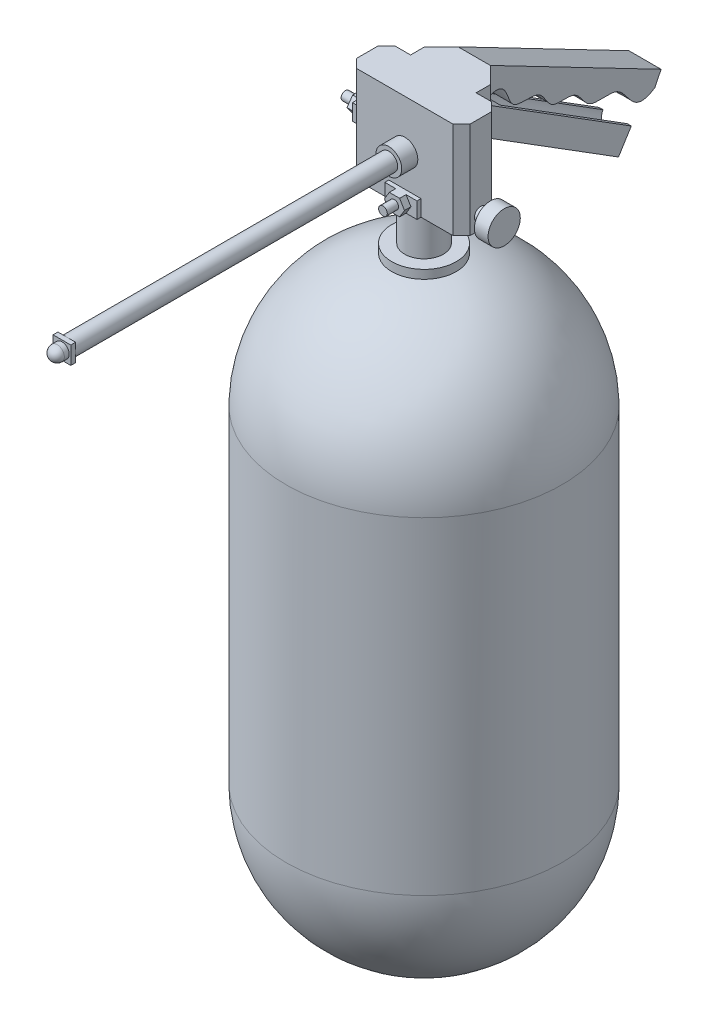
from build123d import *
from build123d.topology import SkipClean

# Parameters (mm, degrees)
SKETCH1_R                = 85.725
BOSS_EXTRUDE1_DEPTH      = 203.2
BOSS_EXTRUDE2_DEPTH      = 3
BOSS_EXTRUDE2_DEPTH_BACK = 3
SKETCH31_R               = 20
SKETCH32_R               = 12
BOSS_EXTRUDE3_DEPTH      = 25
BOSS_EXTRUDE6_DEPTH      = 60
SKETCH34_R               = 4
BOSS_EXTRUDE7_DEPTH      = 6
SKETCH35_R               = 10
BOSS_EXTRUDE8_DEPTH      = 8.5
SKETCH36_W               = 20
SKETCH36_H               = 10
BOSS_EXTRUDE9_DEPTH      = 2.5
BOSS_EXTRUDE10_DEPTH     = 4
SKETCH38_R               = 2.7
BOSS_EXTRUDE11_DEPTH     = 7
SKETCH39_W               = 13.421237438
SKETCH39_H               = 10
BOSS_EXTRUDE12_DEPTH     = 2.5
BOSS_EXTRUDE13_DEPTH     = 4
SKETCH41_R               = 2.7
BOSS_EXTRUDE14_DEPTH     = 7
SKETCH42_R               = 8
BOSS_EXTRUDE15_DEPTH     = 10
SKETCH43_R               = 5.5
BOSS_EXTRUDE16_DEPTH     = 200
SKETCH44_W               = 11
SKETCH44_H               = 11
BOSS_EXTRUDE17_DEPTH     = 3
SKETCH45_R               = 4.5
BOSS_EXTRUDE18_DEPTH     = 3
REVOLVE3_ANGLE           = 180
BOSS_EXTRUDE19_DEPTH     = 16
BOSS_EXTRUDE20_DEPTH     = 20
BOSS_EXTRUDE21_DEPTH     = 20
CUT_EXTRUDE2_DEPTH       = 93


with BuildPart() as part:
    # Sketch1 → Boss-Extrude1 (new body)
    with BuildSketch(Plane(origin=(0, 0, 0), x_dir=(1, 0, 0), z_dir=(0, 1, 0))):
        with Locations(Location((0, 0, 0), (0, 0, 270))):
            Circle(SKETCH1_R)
    extrude(amount=BOSS_EXTRUDE1_DEPTH)

    # Sketch28 → Revolve1 (revolve)
    with BuildSketch(Plane.XY):
        with BuildLine():
            Line((0, 287.318360821), (0, 201.578017622))
            Line((0, 201.578017622), (-85.725, 203.2))
            ThreePointArc((-85.725, 203.2), (-60.051382691, 262.776366365), (0, 287.318360821))
        make_face()
    revolve(axis=Axis((0, 313.857447871, 0), (0, -1, 0)))

    # Sketch29 → Revolve2 (revolve)
    with BuildSketch(Plane.XY, mode=Mode.PRIVATE) as revolve2_sk:
        with BuildLine():
            Line((0, 0), (0, -85.725))
            ThreePointArc((0, -85.725), (60.616728817, -60.616728817), (85.725, 0))
            Line((85.725, 0), (0, 0))
        make_face()
    revolve(revolve2_sk.sketch.rotate(Axis((0, 313.857447871, 0), (0, -1, 0)), 180), axis=Axis((0, 313.857447871, 0), (0, -1, 0)))

    # Sketch31 → Boss-Extrude2 (add, two sides: drawn at the far end of the back side and taken through both)
    with BuildSketch(Plane(origin=(0, 287.318360821, 0), x_dir=(1, 0, 0), z_dir=(0, 1, 0)).offset(-BOSS_EXTRUDE2_DEPTH_BACK)):
        with Locations(Location((0, 0, 0), (0, 0, 180))):
            Circle(SKETCH31_R)
    extrude(amount=BOSS_EXTRUDE2_DEPTH + BOSS_EXTRUDE2_DEPTH_BACK)

    # Sketch32 → Boss-Extrude3 (add)
    with BuildSketch(Plane(origin=(0, 290.318360821, 0), x_dir=(1, 0, 0), z_dir=(0, 1, 0))):
        with Locations(Location((0, 0, 0), (0, 0, 180))):
            Circle(SKETCH32_R)
    extrude(amount=BOSS_EXTRUDE3_DEPTH)

    # Sketch33 → Boss-Extrude6 (add)
    with BuildSketch(Plane(origin=(0, 315.318360821, 0), x_dir=(1, 0, 0), z_dir=(0, 1, 0))):
        Polygon((30, 12), (-30, 12), (-35.289381281, 6.710618719), (-35.289381281, -6.710618719), (-30, -12), (30, -12), (35.289381281, -6.710618719), (35.289381281, 6.710618719), align=None)
    extrude(amount=BOSS_EXTRUDE6_DEPTH)

    # Sketch34 → Boss-Extrude7 (add)
    with BuildSketch(Plane(origin=(35.289381281, 0, 0), x_dir=(0, 0, -1), z_dir=(1, 0, 0))):
        with Locations(Location((0, 323.725459458, 0), (0, 0, 270))):
            Circle(SKETCH34_R)
    extrude(amount=BOSS_EXTRUDE7_DEPTH)

    # Sketch35 → Boss-Extrude8 (add)
    with BuildSketch(Plane(origin=(41.289381281, 0, 0), x_dir=(0, 0, -1), z_dir=(1, 0, 0))):
        with Locations(Location((0, 323.725459458, 0), (0, 0, 90))):
            Circle(SKETCH35_R)
    extrude(amount=BOSS_EXTRUDE8_DEPTH)

    # Sketch36 → Boss-Extrude9 (add)
    with BuildSketch(Plane.XY.offset(12)):
        with Locations((0.143972637, 320.318360821)):
            Rectangle(SKETCH36_W, SKETCH36_H)
    extrude(amount=BOSS_EXTRUDE9_DEPTH)

    # Sketch37 → Boss-Extrude10 (add)
    with BuildSketch(Plane.XY.offset(14.5)):
        Polygon((0.143972637, 325.318360821), (3.343972637, 325.318360821), (6.386363787, 320.318362512), (3.343972637, 315.318360821), (-3.056027363, 315.318360821), (-6.098417484, 320.318360821), (-3.056027363, 325.318360821), align=None)
    extrude(amount=BOSS_EXTRUDE10_DEPTH)

    # Sketch38 → Boss-Extrude11 (add)
    with BuildSketch(Plane.XY.offset(18.5)):
        with Locations((0, 320.318362512)):
            Circle(SKETCH38_R)
    extrude(amount=BOSS_EXTRUDE11_DEPTH)

    # Sketch39 → Boss-Extrude12 (add)
    with BuildSketch(Plane.ZY.offset(35.289381281)):
        with Locations((0, 345.318360821)):
            Rectangle(SKETCH39_W, SKETCH39_H)
    extrude(amount=BOSS_EXTRUDE12_DEPTH)

    # Sketch40 → Boss-Extrude13 (add)
    with BuildSketch(Plane.ZY.offset(37.789381281)):
        Polygon((2.5, 350.318360821), (6.03894233, 345.318360821), (2.5, 340.318360821), (-2.5, 340.318360821), (-6.03894233, 345.318360821), (-2.5, 350.318360821), align=None)
    extrude(amount=BOSS_EXTRUDE13_DEPTH)

    # Sketch41 → Boss-Extrude14 (add)
    with BuildSketch(Plane.ZY.offset(41.789381281)):
        with Locations((0, 345.318360821)):
            Circle(SKETCH41_R)
    extrude(amount=BOSS_EXTRUDE14_DEPTH)

    # Sketch42 → Boss-Extrude15 (add)
    with BuildSketch(Plane.XY.offset(12)):
        with Locations(Location((0.143972637, 345.318360821, 0), (0, 0, 180))):
            Circle(SKETCH42_R)
    extrude(amount=BOSS_EXTRUDE15_DEPTH)

    # Sketch43 → Boss-Extrude16 (add)
    with BuildSketch(Plane.XY.offset(22)):
        with Locations((0.143972637, 345.318360821)):
            Circle(SKETCH43_R)
    extrude(amount=BOSS_EXTRUDE16_DEPTH)

    # Sketch44 → Boss-Extrude17 (add)
    with BuildSketch(Plane.XY.offset(222)):
        with Locations((0.143972637, 345.318360821)):
            Rectangle(SKETCH44_W, SKETCH44_H)
    extrude(amount=BOSS_EXTRUDE17_DEPTH)

    # Sketch45 → Boss-Extrude18 (add)
    with BuildSketch(Plane.XY.offset(225)):
        with Locations(Location((0.143972637, 345.318360821, 0), (0, 0, 180))):
            Circle(SKETCH45_R)
    extrude(amount=BOSS_EXTRUDE18_DEPTH)

    # Sketch47 → Revolve3 (revolve)
    with SkipClean():  # the faces are left unmerged after this step: merging them gives an invalid solid
        with BuildSketch(Plane.XY.offset(228)):
            with BuildLine():
                ThreePointArc((4.643972637, 345.318360821), (3.325953153, 348.500341336), (0.143972637, 349.818360821))
                Line((0.143972637, 349.818360821), (0.143972637, 340.818360821))
                ThreePointArc((0.143972637, 340.818360821), (3.325953153, 342.136380306), (4.643972637, 345.318360821))
            make_face()
            with BuildLine():
                Line((0.143972637, 340.818360821), (0.143972637, 349.818360821))
                ThreePointArc((0.143972637, 349.818360821), (-4.356027363, 345.318360821), (0.143972637, 340.818360821))
            make_face()
        revolve(axis=Axis((0.143972637, 349.818360821, 228), (0, -1, 0)), revolution_arc=REVOLVE3_ANGLE)

    # Sketch48 → Boss-Extrude19 (add)
    with BuildSketch(Plane(origin=(0, 375.318360821, 0), x_dir=(1, 0, 0), z_dir=(0, 1, 0))):
        Polygon((-20.357899108, -12), (-20.357899108, 20.820157016), (-10.038977344, 31.139078781), (10.038977344, 31.139078781), (20.357899108, 20.820157016), (20.357899108, -12), align=None)
    extrude(amount=-BOSS_EXTRUDE19_DEPTH)

    # Sketch52 → Boss-Extrude20 (add)
    with BuildSketch(Plane.ZY.offset(-10.038977344)):
        with BuildLine():
            Line((-31.139078781, 375.318360821), (-137.198476882, 320.216318652))
            Line((-137.198476882, 320.216318652), (-133.330265792, 312.290268057))
            add(Edge.make_bspline(
                [(-31.139078781, 359.318360821), (-42.379778295, 363.158353756), (-39.591693022, 340.818653922), (-62.888798291, 349.099143654), (-67.926909039, 331.053173549), (-84.980722767, 337.146273437), (-91.529623803, 319.105472959), (-116.352369344, 328.68437575), (-119.116532875, 302.808333213), (-133.330265792, 312.290268057)],
                knots=[0, 0, 0, 0, 0.166177643, 0.304820008, 0.403836768, 0.523806209, 0.62872413, 0.776596545, 1, 1, 1, 1], degree=3))
            Line((-31.139078781, 359.318360821), (-31.139078781, 375.318360821))
        make_face()
    extrude(amount=BOSS_EXTRUDE20_DEPTH)

    # Sketch53 → Boss-Extrude21 (add)
    with BuildSketch(Plane.ZY.offset(-10.038977344)):
        Polygon((-25.979617899, 359.318360821), (-25.979617899, 339.318360821), (-110.737722603, 286.251764106), (-118.69771211, 298.965479812), (-31.139078781, 353.785472543), (-31.139078781, 359.318360821), align=None)
    extrude(amount=BOSS_EXTRUDE21_DEPTH)

    # Sketch55 → Cut-Extrude2 (cut)
    with BuildSketch(Plane(origin=(0, 30.802439398, 49.197735399), x_dir=(-1, 0, 0), z_dir=(1.7575320948605254e-15, -0.5306659671461025, -0.8475810470467657))):
        with BuildLine():
            Line((7.49999746, 316.386310605), (-7.49999746, 316.386310605))
            ThreePointArc((-7.49999746, 316.386310605), (0, 308.886313145), (7.49999746, 316.386310605))
        make_face()
    extrude(amount=-CUT_EXTRUDE2_DEPTH, mode=Mode.SUBTRACT)


solid = part.part
